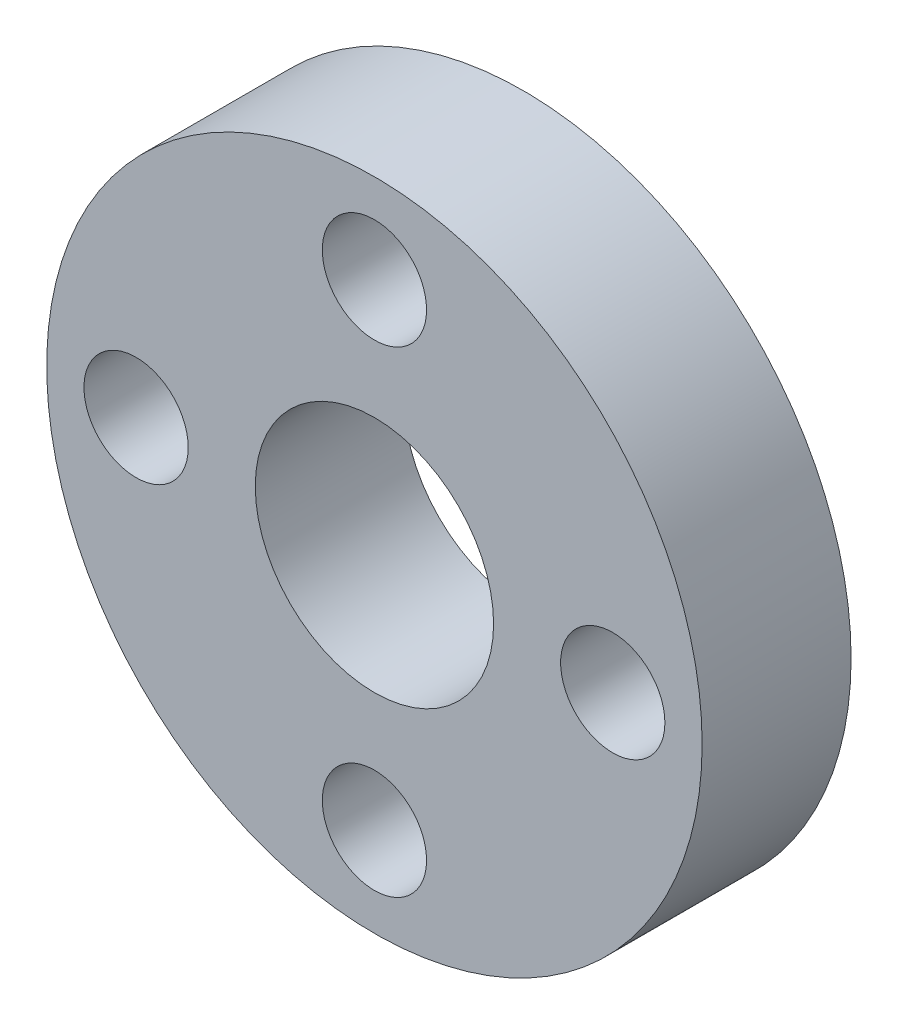
from build123d import *

# Parameters (mm, degrees)
SKETCH_1_R          = 11
SKETCH_1_R_2        = 1.75
EXTRUDE_1_DEPTH     = 5
SKETCH_2_R          = 4
SKETCH_2_R_2        = 2.35
CUT_EXTRUDE_1_DEPTH = 10


with BuildPart() as part:
    # 스케치1 → 보스-돌출1 (new body)
    with BuildSketch(Plane.XY):
        Circle(SKETCH_1_R)
        with Locations((0, 8)):
            Circle(SKETCH_1_R_2, mode=Mode.SUBTRACT)
        with Locations((8, 0)):
            Circle(SKETCH_1_R_2, mode=Mode.SUBTRACT)
        with Locations((0, -8)):
            Circle(SKETCH_1_R_2, mode=Mode.SUBTRACT)
        with Locations((-8, 0)):
            Circle(SKETCH_1_R_2, mode=Mode.SUBTRACT)
    extrude(amount=EXTRUDE_1_DEPTH)

    # 스케치2 → 컷-돌출1 (cut)
    # profile 1 of 2: a face of its own
    with BuildSketch(Plane.XY.offset(5)):
        Circle(SKETCH_2_R)
        Circle(SKETCH_2_R_2, mode=Mode.SUBTRACT)
    # profile 2 of 2: a face of its own
    with BuildSketch(Plane.XY.offset(5)):
        Circle(SKETCH_2_R_2)
    extrude(amount=-CUT_EXTRUDE_1_DEPTH, mode=Mode.SUBTRACT)


solid = part.part
